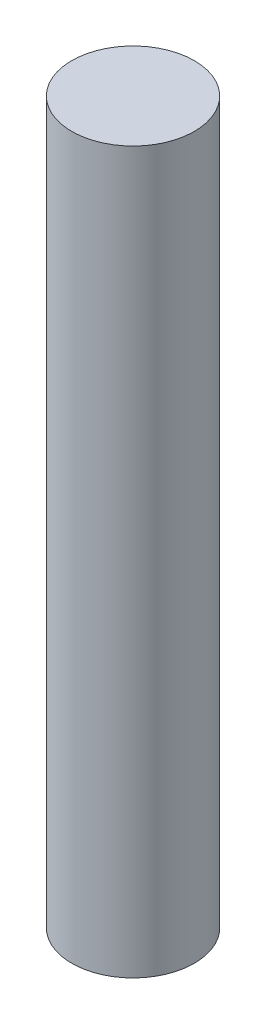
from build123d import *

# Parameters (mm, degrees)
SKETCH1_R           = 40
BOSS_EXTRUDE1_DEPTH = 470


with BuildPart() as part:
    # Sketch1 → Boss-Extrude1 (new body)
    with BuildSketch(Plane(origin=(0, 0, 0), x_dir=(1, 0, 0), z_dir=(0, 1, 0))):
        with Locations(Location((0, 0, 0), (0, 0, 90))):
            Circle(SKETCH1_R)
    extrude(amount=BOSS_EXTRUDE1_DEPTH)


solid = part.part
